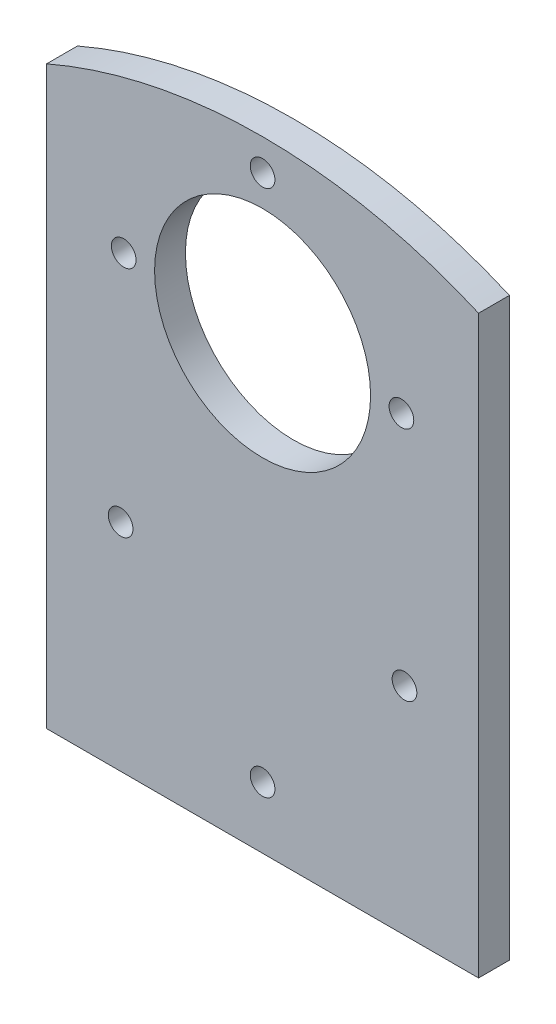
from build123d import *

# Parameters (mm, degrees)
SKETCH1_W           = 70
SKETCH1_H           = 105
BOSS_EXTRUDE1_DEPTH = 5
SKETCH2_R           = 17.5
CUT_EXTRUDE3_DEPTH  = 64.294944506
SKETCH3_R           = 2
CUT_EXTRUDE4_DEPTH  = 64.294944506
SKETCH4_R           = 2
CUT_EXTRUDE5_DEPTH  = 5
CUT_EXTRUDE6_DEPTH  = 10


with BuildPart() as part:
    # Sketch1 → Boss-Extrude1 (new body)
    with BuildSketch(Plane.XY):
        Rectangle(SKETCH1_W, SKETCH1_H)
    extrude(amount=BOSS_EXTRUDE1_DEPTH)

    # Sketch2 → Cut-Extrude3 (cut, through all)
    with BuildSketch(Plane(origin=(0, 0, 0), x_dir=(-1, 0, 0), z_dir=(0, 0, -1))):
        with Locations((0, 20.5)):
            Circle(SKETCH2_R)
    extrude(amount=-CUT_EXTRUDE3_DEPTH, mode=Mode.SUBTRACT)

    # Sketch3 → Cut-Extrude4 (cut, through all)
    with BuildSketch(Plane.XY.offset(5)):
        with Locations((-22.5, 20.5)):
            Circle(SKETCH3_R)
        with Locations((0, 43)):
            Circle(SKETCH3_R)
        with Locations((22.5, 20.5)):
            Circle(SKETCH3_R)
    extrude(amount=-CUT_EXTRUDE4_DEPTH, mode=Mode.SUBTRACT)

    # Sketch4 → Cut-Extrude5 (cut)
    with BuildSketch(Plane.XY.offset(5)):
        with Locations((0, -42.5)):
            Circle(SKETCH4_R)
        with Locations((-23, -17.5)):
            Circle(SKETCH4_R)
        with Locations(Location((23, -17.5, 0), (0, 0, 180))):
            Circle(SKETCH4_R)
    extrude(amount=-CUT_EXTRUDE5_DEPTH, mode=Mode.SUBTRACT)

    # Sketch5 → Cut-Extrude6 (cut)
    with BuildSketch(Plane.XY.offset(5)):
        with BuildLine():
            Line((-35, 40.793543502), (-35, 52.5))
            Line((-35, 52.5), (35, 52.5))
            Line((35, 52.5), (35, 40.793543502))
            ThreePointArc((35, 40.793543502), (0, 48.07644174), (-35, 40.793543502))
        make_face()
    extrude(amount=-CUT_EXTRUDE6_DEPTH, mode=Mode.SUBTRACT)


solid = part.part
